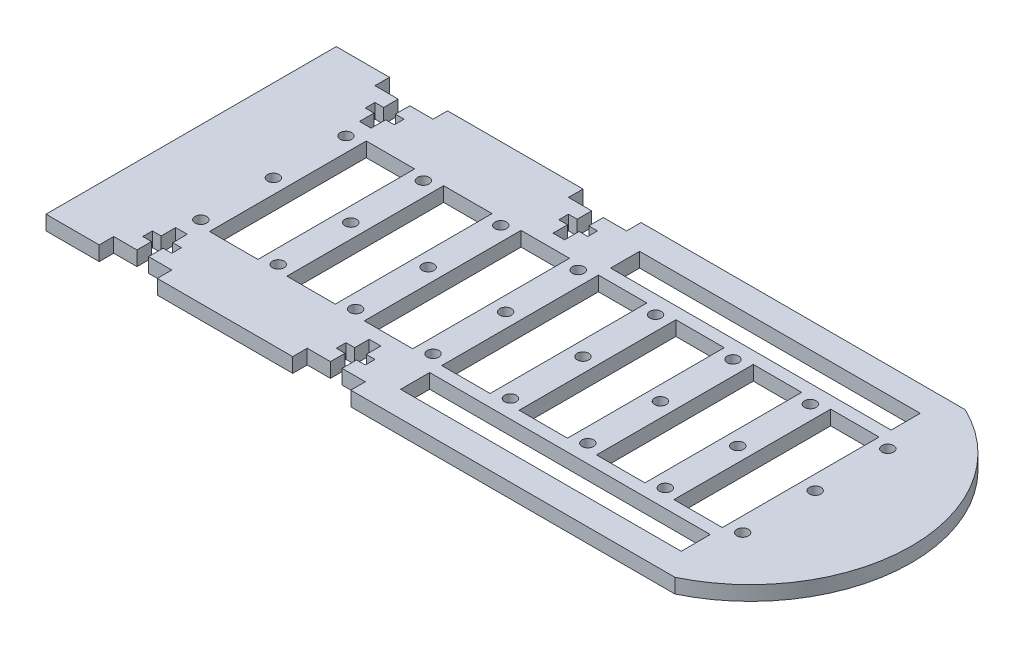
from build123d import *

# Parameters (mm, degrees)
BOSS_EXTRUDE1_DEPTH  = 3.81
CUT_EXTRUDE8_DEPTH   = 103.498384567
MIRROR6_COPY_1_DEPTH = 103.498384567
SKETCH5_R            = 1.524
CUT_EXTRUDE2_DEPTH   = 103.498384567
LPATTERN1_COUNT      = 3
LPATTERN1_PITCH      = 19.05
LPATTERN1_COUNT_DIR2 = 8
LPATTERN1_PITCH_DIR2 = 20.32
SKETCH6_W            = 12.7
SKETCH6_H            = 41.148
CUT_EXTRUDE5_DEPTH   = 103.498384567
LPATTERN2_COUNT      = 3
LPATTERN2_PITCH      = 20.32
LPATTERN3_COUNT      = 5
LPATTERN3_PITCH      = 20.32
SKETCH7_W            = 73.66
SKETCH7_H            = 7.62
CUT_EXTRUDE6_DEPTH   = 103.498384567


with BuildPart() as part:
    # Sketch2 → Boss-Extrude1 (new body)
    with BuildSketch(Plane(origin=(0, 0, 0), x_dir=(1, 0, 0), z_dir=(0, 1, 0))):
        with BuildLine():
            Line((-93.98, 38.1), (-93.98, -38.1))
            Line((-93.98, -38.1), (71.12, -38.1))
            ThreePointArc((71.12, -38.1), (95.077824642, 0), (71.12, 38.1))
            Line((71.12, 38.1), (-93.98, 38.1))
        make_face()
    extrude(amount=BOSS_EXTRUDE1_DEPTH)

    # Sketch9 → Cut-Extrude8 (cut, symmetric)
    with BuildSketch(Plane.XZ):
        Polygon((-80.01, 430.001486449), (-80.01, 38.1), (-80.01, 34.29), (-73.914, 34.29), (-73.914, 30.48), (-76.2, 30.48), (-76.2, 27.94), (-73.914, 27.94), (-73.914, 24.13), (-70.866, 24.13), (-70.866, 27.94), (-68.58, 27.94), (-68.58, 30.48), (-70.866, 30.48), (-70.866, 34.29), (-64.77, 34.29), (-64.77, 38.1), (-64.77, 430.001486449), (-64.77, 1213.804459348), (-80.01, 1213.804459348), align=None)
    cut_extrude8 = extrude(amount=CUT_EXTRUDE8_DEPTH, both=True, mode=Mode.SUBTRACT)

    # Mirror5: Cut-Extrude8 across plane
    add(cut_extrude8.mirror(Plane(origin=(-46.99, 0, 0), x_dir=(0, 0, 1), z_dir=(1, 0, 0))), mode=Mode.SUBTRACT)

    # Mirror6: Cut-Extrude8 across plane
    add(cut_extrude8.mirror(Plane.XY), mode=Mode.SUBTRACT)

    # Mirror6 copy 1 sketch → Mirror6 copy 1 (cut, symmetric)
    with BuildSketch(Plane(origin=(-93.98, 0, 0), x_dir=(-1, 0, 0), z_dir=(0, -1, 0))):
        Polygon((-80.01, 430.001486449), (-80.01, 38.1), (-80.01, 34.29), (-73.914, 34.29), (-73.914, 30.48), (-76.2, 30.48), (-76.2, 27.94), (-73.914, 27.94), (-73.914, 24.13), (-70.866, 24.13), (-70.866, 27.94), (-68.58, 27.94), (-68.58, 30.48), (-70.866, 30.48), (-70.866, 34.29), (-64.77, 34.29), (-64.77, 38.1), (-64.77, 430.001486449), (-64.77, 1213.804459348), (-80.01, 1213.804459348), align=None)
    extrude(amount=MIRROR6_COPY_1_DEPTH, both=True, mode=Mode.SUBTRACT)

    # Sketch5 → Cut-Extrude2 (cut, through all)
    with BuildSketch(Plane.XZ):
        with Locations(Location((-72.39, 19.05, 0), (0, 0, 270))):
            Circle(SKETCH5_R)
    cut_extrude2 = extrude(amount=-CUT_EXTRUDE2_DEPTH, mode=Mode.SUBTRACT)

    # LPattern1: Cut-Extrude2 3 × 8
    with Locations(*[(j * LPATTERN1_PITCH_DIR2, 0, -i * LPATTERN1_PITCH) for i in range(LPATTERN1_COUNT) for j in range(LPATTERN1_COUNT_DIR2) if (i, j) != (0, 0)]):
        add(cut_extrude2, mode=Mode.SUBTRACT)

    # Sketch6 → Cut-Extrude5 (cut, through all)
    with BuildSketch(Plane.XZ):
        with Locations((-21.59, 0)):
            Rectangle(SKETCH6_W, SKETCH6_H)
    cut_extrude5 = extrude(amount=-CUT_EXTRUDE5_DEPTH, mode=Mode.SUBTRACT)

    # LPattern2: Cut-Extrude5 ×3
    with Locations(*[(-i * LPATTERN2_PITCH, 0, 0) for i in range(1, LPATTERN2_COUNT)]):
        add(cut_extrude5, mode=Mode.SUBTRACT)

    # LPattern3: Cut-Extrude5 ×5
    with Locations(*[(i * LPATTERN3_PITCH, 0, 0) for i in range(1, LPATTERN3_COUNT)]):
        add(cut_extrude5, mode=Mode.SUBTRACT)

    # Sketch7 → Cut-Extrude6 (cut, through all)
    with BuildSketch(Plane.XZ):
        with Locations((29.21, 27.559)):
            Rectangle(SKETCH7_W, SKETCH7_H)
    cut_extrude6 = extrude(amount=-CUT_EXTRUDE6_DEPTH, mode=Mode.SUBTRACT)

    # Mirror3: Cut-Extrude6 across plane
    add(cut_extrude6.mirror(Plane.XY), mode=Mode.SUBTRACT)


solid = part.part
